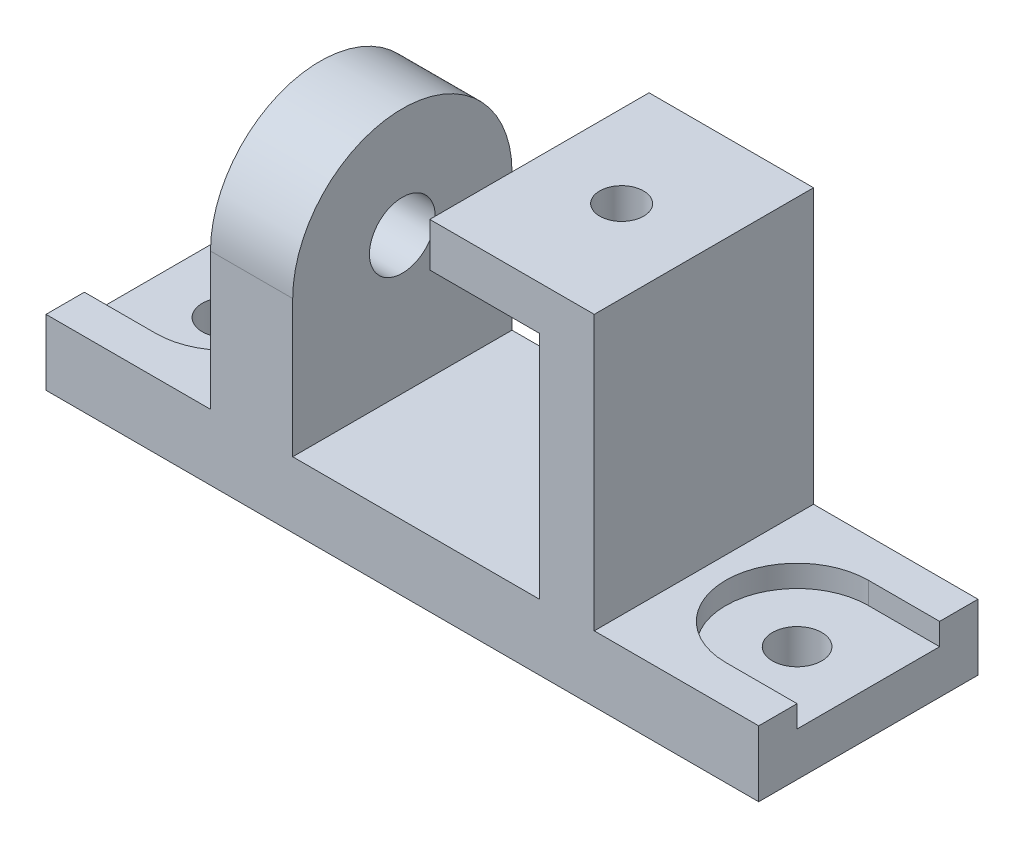
from build123d import *

# Parameters (mm, degrees)
ESBO_O1_W                  = 130
ESBO_O1_H                  = 40
RESSALTO_EXTRUS_O1_DEPTH   = 12
CORTE_EXTRUS_O3_DEPTH      = 70.057946682
CORTE_EXTRUS_O3_DEPTH_BACK = 4
CORTE_EXTRUS_O4_DEPTH      = 70.057946682
CORTE_EXTRUS_O4_DEPTH_BACK = 4
ESBO_O5_R                  = 4.5
CORTE_EXTRUS_O5_DEPTH      = 69.476273263
ESBO_O7_W                  = 15
ESBO_O7_H                  = 40
RESSALTO_EXTRUS_O2_DEPTH   = 50
ESBO_O8_W                  = 10
ESBO_O8_H                  = 40
RESSALTO_EXTRUS_O3_DEPTH   = 50
ESBO_O9_W                  = 40
ESBO_O9_H                  = 8
RESSALTO_EXTRUS_O4_DEPTH   = 20
ESBO_O10_R                 = 4
CORTE_EXTRUS_O6_DEPTH      = 20
CORTE_EXTRUS_O7_DEPTH      = 20
ESBO_O12_R                 = 6
CORTE_EXTRUS_O8_DEPTH      = 20


with BuildPart() as part:
    # Esboço1 → Ressalto-extrusão1 (new body)
    with BuildSketch(Plane(origin=(0, 0, 0), x_dir=(1, 0, 0), z_dir=(0, 1, 0))):
        Rectangle(ESBO_O1_W, ESBO_O1_H)
    extrude(amount=RESSALTO_EXTRUS_O1_DEPTH)

    # Esboço3 → Corte-extrusão3 (cut, two sides: drawn at the far end of the back side and taken through both)
    with BuildSketch(Plane(origin=(0, 12, 0), x_dir=(1, 0, 0), z_dir=(0, 1, 0)).offset(-CORTE_EXTRUS_O3_DEPTH_BACK)):
        with BuildLine():
            Line((-52, 13), (-65, 13))
            Line((-65, 13), (-65, -13))
            Line((-65, -13), (-52, -13))
            ThreePointArc((-52, -13), (-39, 0), (-52, 13))
        make_face()
    extrude(amount=CORTE_EXTRUS_O3_DEPTH + CORTE_EXTRUS_O3_DEPTH_BACK, mode=Mode.SUBTRACT)

    # Esboço4 → Corte-extrusão4 (cut, two sides: drawn at the far end of the back side and taken through both)
    with BuildSketch(Plane(origin=(0, 12, 0), x_dir=(1, 0, 0), z_dir=(0, 1, 0)).offset(-CORTE_EXTRUS_O4_DEPTH_BACK)):
        with BuildLine():
            Line((343.246155611, 13), (65, 13))
            Line((65, 13), (52, 13))
            ThreePointArc((52, 13), (39, 0), (52, -13))
            Line((52, -13), (65, -13))
            Line((65, -13), (343.246155611, -13))
            Line((343.246155611, -13), (899.738466833, -13))
            Line((899.738466833, -13), (899.738466833, 13))
            Line((899.738466833, 13), (343.246155611, 13))
        make_face()
    extrude(amount=CORTE_EXTRUS_O4_DEPTH + CORTE_EXTRUS_O4_DEPTH_BACK, mode=Mode.SUBTRACT)

    # Esboço5 → Corte-extrusão5 (cut, through all)
    with BuildSketch(Plane(origin=(0, 8, 0), x_dir=(1, 0, 0), z_dir=(0, 1, 0))):
        with Locations(Location((-52, 0, 0), (0, 0, 270))):
            Circle(ESBO_O5_R)
        with Locations(Location((52, 0, 0), (0, 0, 270))):
            Circle(ESBO_O5_R)
    extrude(amount=-CORTE_EXTRUS_O5_DEPTH, mode=Mode.SUBTRACT)

    # Esboço7 → Ressalto-extrusão2 (add)
    with BuildSketch(Plane(origin=(0, 12, 0), x_dir=(1, 0, 0), z_dir=(0, 1, 0))):
        with Locations((-27.5, 0)):
            Rectangle(ESBO_O7_W, ESBO_O7_H)
    extrude(amount=RESSALTO_EXTRUS_O2_DEPTH)

    # Esboço8 → Ressalto-extrusão3 (add)
    with BuildSketch(Plane(origin=(0, 12, 0), x_dir=(1, 0, 0), z_dir=(0, 1, 0))):
        with Locations((30, 0)):
            Rectangle(ESBO_O8_W, ESBO_O8_H)
    extrude(amount=RESSALTO_EXTRUS_O3_DEPTH)

    # Esboço9 → Ressalto-extrusão4 (add)
    with BuildSketch(Plane.ZY.offset(-25)):
        with Locations((0, 58)):
            Rectangle(ESBO_O9_W, ESBO_O9_H)
    extrude(amount=RESSALTO_EXTRUS_O4_DEPTH)

    # Esboço10 → Corte-extrusão6 (cut)
    with BuildSketch(Plane(origin=(0, 62, 0), x_dir=(1, 0, 0), z_dir=(0, 1, 0))):
        with Locations(Location((20, 0, 0), (0, 0, 270))):
            Circle(ESBO_O10_R)
    extrude(amount=-CORTE_EXTRUS_O6_DEPTH, mode=Mode.SUBTRACT)

    # Esboço11 → Corte-extrusão7 (cut)
    with BuildSketch(Plane.ZY.offset(35)):
        with BuildLine():
            Line((-20, 37), (-20, 62))
            Line((-20, 62), (20, 62))
            Line((20, 62), (20, 37))
            ThreePointArc((20, 37), (0, 57), (-20, 37))
        make_face()
    extrude(amount=-CORTE_EXTRUS_O7_DEPTH, mode=Mode.SUBTRACT)

    # Esboço12 → Corte-extrusão8 (cut)
    with BuildSketch(Plane.ZY.offset(35)):
        with Locations((0, 37)):
            Circle(ESBO_O12_R)
    extrude(amount=-CORTE_EXTRUS_O8_DEPTH, mode=Mode.SUBTRACT)


solid = part.part
